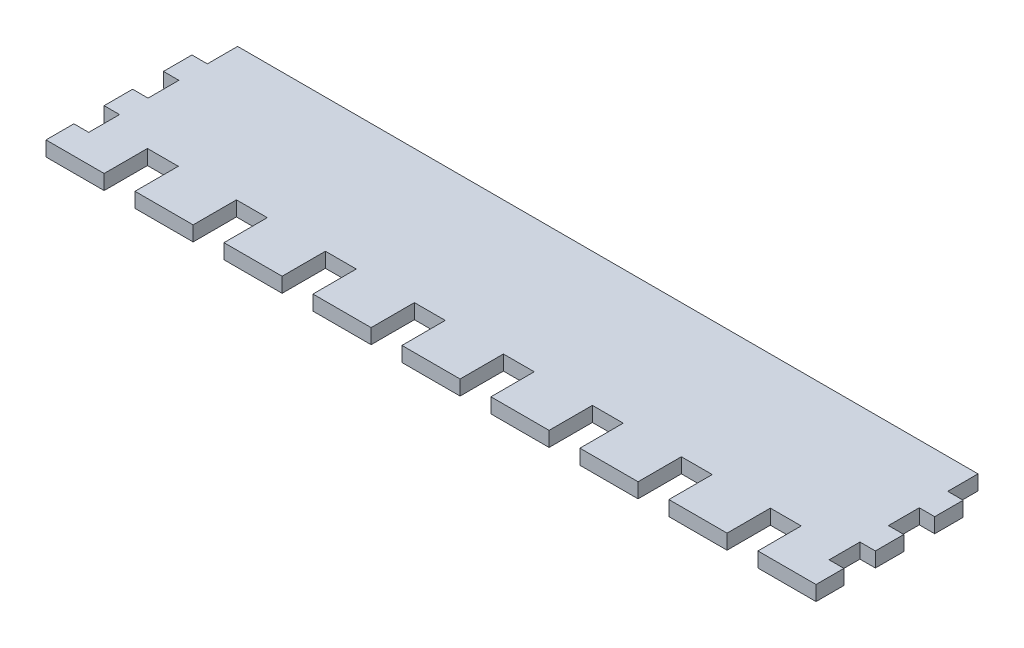
from build123d import *

# Parameters (mm, degrees)
SKETCH1_W           = 330.2
SKETCH1_H           = 57.15
BOSS_EXTRUDE1_DEPTH = 6.35
SKETCH3_W           = 24.892
SKETCH3_H           = 18.542
BOSS_EXTRUDE2_DEPTH = 6.35
SKETCH4_W           = 13.208
SKETCH4_H           = 13.208
CUT_EXTRUDE2_DEPTH  = 172.809034073


with BuildPart() as part:
    # Sketch1 → Boss-Extrude1 (new body)
    with BuildSketch(Plane(origin=(0, 0, 0), x_dir=(1, 0, 0), z_dir=(0, 1, 0))):
        Rectangle(SKETCH1_W, SKETCH1_H)
    extrude(amount=BOSS_EXTRUDE1_DEPTH)

    # Sketch3 → Boss-Extrude2 (add)
    with BuildSketch(Plane(origin=(0, 0, 0), x_dir=(1, 0, 0), z_dir=(0, 1, 0))):
        with Locations((-114.3, -37.846)):
            Rectangle(SKETCH3_W, SKETCH3_H)
        with Locations((-76.2, -37.846)):
            Rectangle(SKETCH3_W, SKETCH3_H)
        with Locations((-38.1, -37.846)):
            Rectangle(SKETCH3_W, SKETCH3_H)
        with Locations((0, -37.846)):
            Rectangle(SKETCH3_W, SKETCH3_H)
        with Locations((38.1, -37.846)):
            Rectangle(SKETCH3_W, SKETCH3_H)
        with Locations((76.2, -37.846)):
            Rectangle(SKETCH3_W, SKETCH3_H)
        with Locations((114.3, -37.846)):
            Rectangle(SKETCH3_W, SKETCH3_H)
        with Locations((152.4, -37.846)):
            Rectangle(SKETCH3_W, SKETCH3_H)
        with Locations((-152.4, -37.846)):
            Rectangle(SKETCH3_W, SKETCH3_H)
    extrude(amount=BOSS_EXTRUDE2_DEPTH)

    # Sketch4 → Cut-Extrude2 (cut, through all)
    with BuildSketch(Plane(origin=(0, 0, 0), x_dir=(1, 0, 0), z_dir=(0, 1, 0))):
        with Locations((165.1, 22.225)):
            Rectangle(SKETCH4_W, SKETCH4_H)
        with Locations((-165.1, -28.575)):
            Rectangle(SKETCH4_W, SKETCH4_H)
        with Locations((165.1, -3.175)):
            Rectangle(SKETCH4_W, SKETCH4_H)
        with Locations((165.1, -28.575)):
            Rectangle(SKETCH4_W, SKETCH4_H)
        with Locations((-165.1, -3.175)):
            Rectangle(SKETCH4_W, SKETCH4_H)
        with Locations((-165.1, 22.225)):
            Rectangle(SKETCH4_W, SKETCH4_H)
    extrude(amount=CUT_EXTRUDE2_DEPTH, mode=Mode.SUBTRACT)


solid = part.part
